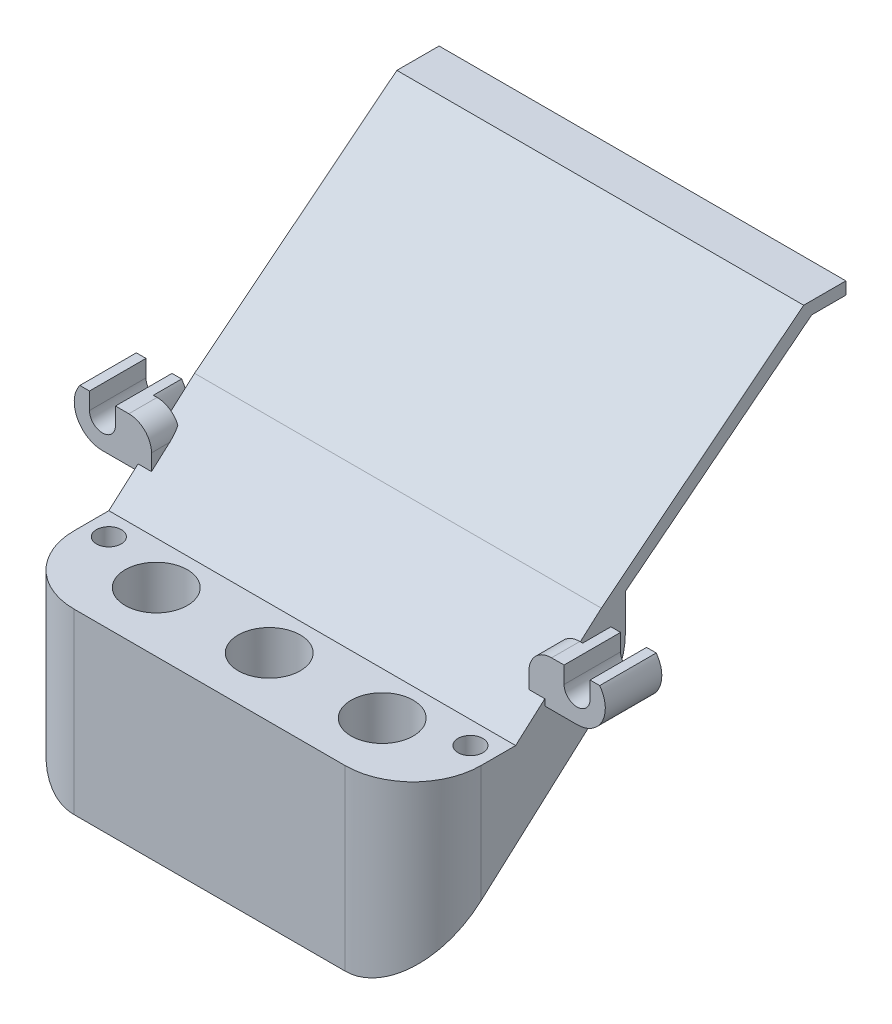
from build123d import *

# Parameters (mm, degrees)
ESQUISSE1_R                  = 2.4999999999999893
ESQUISSE1_R_2                = 1.1499999999999992
EXTRUSION1_DEPTH             = 5
ESQUISSE1_R_3                = 2.5000000000000027
EXTRUSION1_2_DEPTH           = 5
EXTRUSION2_DEPTH             = 18
EXTRUSION3_DEPTH             = 2.5
ENL_V_MAT_EXTRU_1_DEPTH      = 39.32538157223775
ENL_V_MAT_EXTRU_1_DEPTH_BACK = 39.32538157223775
ESQUISSE4_R                  = 2.749999999999997
ESQUISSE4_R_2                = 2.749999999999998
CONG_3_R                     = 2
ENL_V_MAT_EXTRU_3_DEPTH      = 102.20266619760267
ENL_V_MAT_EXTRU_5_DEPTH      = 106.71602432156358
ENL_V_MAT_EXTRU_6_REACH      = 81.21
CONG_4_R                     = 6
CONG_5_R                     = 6
ESQUISSE9_R                  = 1.100000000000001
ESQUISSE9_R_2                = 1.0999999999999992
ENL_V_MAT_EXTRU_7_DEPTH      = 6


with BuildPart() as part:
    # Esquisse1 → Extrusion1 (new body)
    with BuildSketch(Plane.XY):
        with Locations((20.851873368125936, -74.73281291154764)):
            Circle(ESQUISSE1_R)
        with Locations((20.851873368125936, -74.73281291154764)):
            Circle(ESQUISSE1_R_2, mode=Mode.SUBTRACT)
    extrude(amount=EXTRUSION1_DEPTH)



with BuildPart() as body_2:
    # Esquisse1 → Extrusion1 2 (new body)
    with BuildSketch(Plane.XY):
        with Locations((-21.148126631874074, -74.73281291154764)):
            Circle(ESQUISSE1_R_3)
        with Locations((-21.148126631874074, -74.73281291154764)):
            Circle(ESQUISSE1_R_2, mode=Mode.SUBTRACT)
    extrude(amount=EXTRUSION1_2_DEPTH)


with BuildPart() as body_3:
    # Esquisse2 → Extrusion2 (new, symmetric)
    with BuildSketch(Plane(origin=(0, 0, 0), x_dir=(0, 0, -1), z_dir=(1, 0, 0))):
        Polygon((-16.664409805958893, -94.72524914650984), (-16.664409805958893, -78.97076866014885), (-7.5846798827186035, -78.97076866014885), (0, -72.23281291154765), (17.904062513857752, -57.96690094689117), (21.643440589343484, -57.97016684873832), (21.641519151826778, -60.17016600966495), (13.695222620932038, -67.54623887711948), align=None)
    extrude(amount=EXTRUSION2_DEPTH, both=True)


with BuildPart() as part_1:
    add(part.part)

    add(body_2.part)  # Extrusion3 merges body 2

    add(body_3.part)  # Extrusion3 merges body 3
    # Esquisse3 → Extrusion3 (add)
    with BuildSketch(Plane.XY.offset(2.5)):
        with BuildLine():
            Line((-23.15262617413516, -73.23883112281155), (-22.298126631874073, -73.23883112281155))
            Line((-22.298126631874073, -73.23883112281155), (-22.298126631874073, -74.73281291154764))
            ThreePointArc((-22.298126631874073, -74.73281291154764), (-21.148126631874074, -75.88281291154763), (-19.998126631874076, -74.73281291154764))
            Line((-19.998126631874076, -74.73281291154764), (-19.998126631874076, -73.23883112281155))
            Line((-19.998126631874076, -73.23883112281155), (-19.143627089612984, -73.23883112281155))
            Line((-19.143627089612984, -73.23883112281155), (-16.812156322257874, -73.23883112281158))
            Line((-16.812156322257874, -73.23883112281158), (-16.8121563222579, -77.23281291154763))
            Line((-16.8121563222579, -77.23281291154763), (-21.148126631874074, -77.23281291154764))
            ThreePointArc((-21.148126631874074, -77.23281291154764), (-23.382511834993743, -75.85420613610354), (-23.15262617413516, -73.23883112281155))
        make_face()
        with BuildLine():
            Line((18.847373825864864, -73.23883112281155), (19.701873368125938, -73.23883112281155))
            Line((19.701873368125938, -73.23883112281155), (19.701873368125938, -74.73281291154764))
            ThreePointArc((19.701873368125938, -74.73281291154764), (20.851873368125936, -75.88281291154763), (22.001873368125935, -74.73281291154764))
            Line((22.001873368125935, -74.73281291154764), (22.001873368125935, -73.23883112281155))
            Line((22.001873368125935, -73.23883112281155), (22.85637291038701, -73.23883112281155))
            ThreePointArc((22.85637291038701, -73.23883112281155), (23.0862585712456, -75.85420613610351), (20.85187336812597, -77.23281291154763))
            Line((20.85187336812597, -77.23281291154763), (16.59665054376802, -77.23281291154761))
            Line((16.59665054376802, -77.23281291154761), (16.59665054376802, -73.23883112281155))
            Line((16.59665054376802, -73.23883112281155), (18.847373825864864, -73.23883112281155))
        make_face()
    extrude(amount=EXTRUSION3_DEPTH)

    # Esquisse4 → Enlèv. mat.-Extru.1 (cut, two sides: drawn at the far end of the back side and taken through both)
    with BuildSketch(Plane(origin=(0, -78.97076866014885, 0), x_dir=(-1, 0, 0), z_dir=(0, 1, 0)).offset(-ENL_V_MAT_EXTRU_1_DEPTH_BACK)):
        with Locations(Location((-9.992794939980836, 11.38535169586409, 0), (0, 0, 270))):
            Circle(ESQUISSE4_R)
        with Locations(Location((0.00720473933372518, 11.382819165765587, 0), (0, 0, 270))):
            Circle(ESQUISSE4_R_2)
        with Locations(Location((10.007204418648286, 11.380286635667082, 0), (0, 0, 270))):
            Circle(ESQUISSE4_R_2)
    extrude(amount=ENL_V_MAT_EXTRU_1_DEPTH + ENL_V_MAT_EXTRU_1_DEPTH_BACK, mode=Mode.SUBTRACT)

    # Congé3
    cong_3_edges = [part_1.edges().sort_by_distance(p)[0] for p in [
        (-16.812156322257874, -73.23883112281158, 3.75),
        (16.59665054376802, -73.23883112281155, 3.75),
    ]]
    fillet(cong_3_edges, radius=CONG_3_R)

    # Esquisse6 → Enlèv. mat.-Extru.3 (cut, through all)
    with BuildSketch(Plane.XY.offset(5)):
        with BuildLine():
            Line((19.701873368125938, -73.23883112281155), (18.847373825864864, -73.23883112281155))
            ThreePointArc((18.847373825864864, -73.23883112281155), (20.851873368125936, -72.23281291154765), (22.85637291038701, -73.23883112281155))
            Line((22.85637291038701, -73.23883112281155), (22.001873368125935, -73.23883112281155))
            Line((22.001873368125935, -73.23883112281155), (22.001873368125935, -74.73281291154764))
            ThreePointArc((22.001873368125935, -74.73281291154764), (20.851873368125936, -75.88281291154763), (19.701873368125938, -74.73281291154764))
            Line((19.701873368125938, -74.73281291154764), (19.701873368125938, -73.23883112281155))
        make_face()
        with BuildLine():
            Line((-19.143627089612988, -73.23883112281155), (-19.998126631874076, -73.23883112281155))
            Line((-19.998126631874076, -73.23883112281155), (-19.998126631874076, -74.73281291154764))
            ThreePointArc((-19.998126631874076, -74.73281291154764), (-21.148126631874074, -75.88281291154763), (-22.298126631874073, -74.73281291154764))
            Line((-22.298126631874073, -74.73281291154764), (-22.298126631874073, -73.23883112281155))
            Line((-22.298126631874073, -73.23883112281155), (-23.15262617413516, -73.23883112281155))
            ThreePointArc((-23.15262617413516, -73.23883112281155), (-21.148126631874074, -72.23281291154764), (-19.143627089612988, -73.23883112281155))
        make_face()
    extrude(amount=-ENL_V_MAT_EXTRU_3_DEPTH, mode=Mode.SUBTRACT)

    # Esquisse7 → Enlèv. mat.-Extru.5 (cut, through all)
    with BuildSketch(Plane(origin=(18, 0, 0), x_dir=(0, 0, -1), z_dir=(1, 0, 0))):
        Polygon((22.38759689084557, -59.06637403320253), (18.619915990338253, -59.06637403320253), (2.127272735037141, -72.00940646483387), (2.127272735037142, -79.68956966642843), (22.38759689084557, -60.215467045024496), align=None)
    extrude(amount=-ENL_V_MAT_EXTRU_5_DEPTH, mode=Mode.SUBTRACT)

    # Enlèv. mat.-Extru.6: up to this plane
    enl_v_mat_extru_6_end = Plane(origin=(-23.648126631874074, -59.06637403320253, -18.619915990338253), z_dir=(0, 0.7866767496715903, 0.6173651201081433))
    # Esquisse8 → Enlèv. mat.-Extru.6 (cut, up to the surface)
    with BuildSketch(Plane(origin=(0, -44.301458010279546, -39.66022266935793), x_dir=(1, 0, 0), z_dir=(0, -0.745056791328178, -0.6670010327546427)), mode=Mode.PRIVATE) as enl_v_mat_extru_6_sk1:
        Polygon((16.22439568808015, 59.743411480582274), (-16.434037279491676, 59.74341148058227), (-16.43403727949168, 40.55997816141156), (16.22439568808015, 40.559978161411564), align=None)
    enl_v_mat_extru_6_tool1 = split(extrude(enl_v_mat_extru_6_sk1.sketch, amount=-ENL_V_MAT_EXTRU_6_REACH, mode=Mode.PRIVATE), bisect_by=enl_v_mat_extru_6_end, keep=Keep.BOTH, mode=Mode.PRIVATE)
    add(enl_v_mat_extru_6_tool1.solids().sort_by_distance((-0.104821, -77.75269, -2.294362))[0], mode=Mode.SUBTRACT)

    # Congé4
    cong_4_edges = [part_1.edges().sort_by_distance(p)[0] for p in [
        (-17.217018639745838, -77.90227429690431, -2.127272735037141),
        (17.112197844040075, -77.90227429690431, -2.127272735037141),
    ]]
    fillet(cong_4_edges, radius=CONG_4_R)

    # Congé5
    cong_5_edges = [part_1.edges().sort_by_distance(p)[0] for p in [
        (-18, -86.84800890332934, 16.664409805958893),
        (18, -86.84800890332934, 16.664409805958893),
    ]]
    fillet(cong_5_edges, radius=CONG_5_R)

    # Esquisse9 → Enlèv. mat.-Extru.7 (cut)
    with BuildSketch(Plane(origin=(0, -78.97076866014885, 0), x_dir=(-1, 0, 0), z_dir=(0, 1, 0))):
        with Locations(Location((-16, 9.584679882718603, 0), (0, 0, 90))):
            Circle(ESQUISSE9_R)
        with Locations(Location((16, 9.584679882718603, 0), (0, 0, 90))):
            Circle(ESQUISSE9_R_2)
    extrude(amount=-ENL_V_MAT_EXTRU_7_DEPTH, mode=Mode.SUBTRACT)


solid = part_1.part
